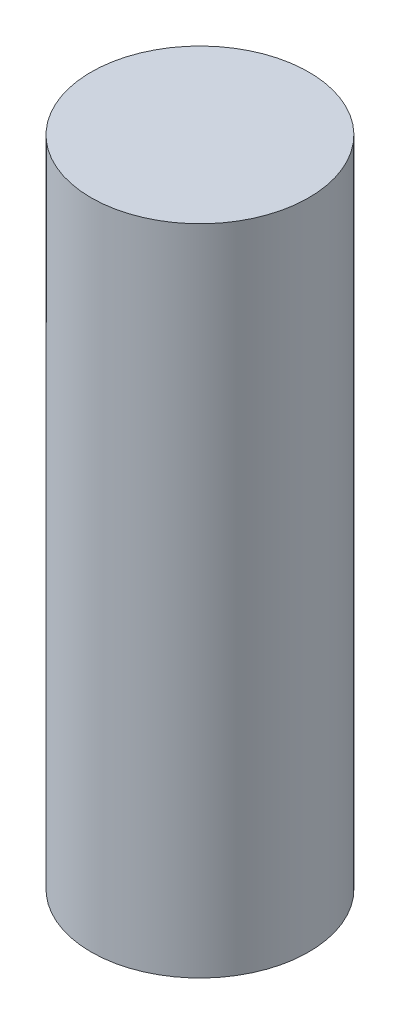
from build123d import *

# Parameters (mm, degrees)
SKETCH2_R           = 5
BOSS_EXTRUDE1_DEPTH = 30
SKETCH3_R           = 2.5
CUT_EXTRUDE1_DEPTH  = 10
CUT_EXTRUDE2_DEPTH  = 10


with BuildPart() as part:
    # Sketch2 → Boss-Extrude1 (new body)
    with BuildSketch(Plane(origin=(0, 0, 0), x_dir=(1, 0, 0), z_dir=(0, 1, 0))):
        with Locations(Location((0, 0, 0), (0, 0, 270))):
            Circle(SKETCH2_R)
    extrude(amount=BOSS_EXTRUDE1_DEPTH)

    # Sketch3 → Cut-Extrude1 (cut)
    with BuildSketch(Plane(origin=(0, 0, 0), x_dir=(-1, 0, 0), z_dir=(0, -1, 0))):
        with Locations(Location((0, 0, 0), (0, 0, 90))):
            Circle(SKETCH3_R)
    extrude(amount=-CUT_EXTRUDE1_DEPTH, mode=Mode.SUBTRACT)

    # Sketch4 → Cut-Extrude2 (cut)
    with BuildSketch(Plane.XZ.offset(-10)):
        with BuildLine():
            Line((2, 1.5), (2, -1.5))
            ThreePointArc((2, -1.5), (-2.5, 0), (2, 1.5))
        make_face()
    extrude(amount=-CUT_EXTRUDE2_DEPTH, mode=Mode.SUBTRACT)


solid = part.part
